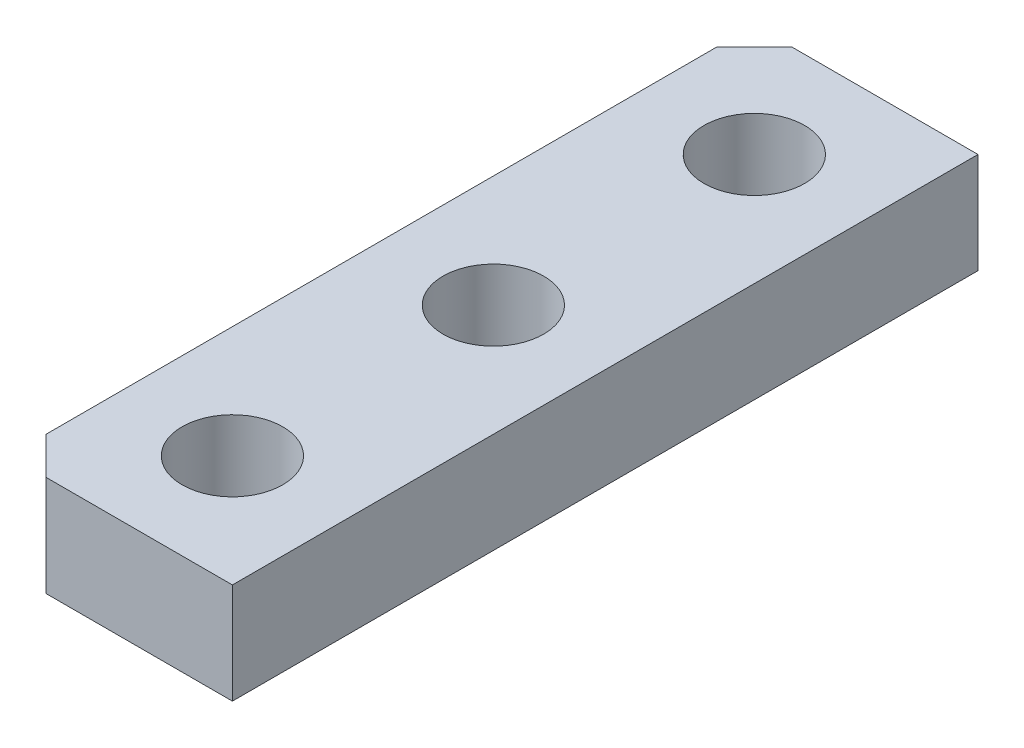
from build123d import *

# Parameters (mm, degrees)
SKETCH1_W             = 30
SKETCH1_H             = 100
BOSS_EXTRUDE1_DEPTH   = 13.5
M12_CLEARANCE_HOLE1_D = 13.5
CHAMFER1_SIZE         = 5


with BuildPart() as part:
    # Sketch1 → Boss-Extrude1 (new body)
    with BuildSketch(Plane(origin=(0, 0, 0), x_dir=(1, 0, 0), z_dir=(0, 1, 0))):
        Rectangle(SKETCH1_W, SKETCH1_H)
    extrude(amount=BOSS_EXTRUDE1_DEPTH)

    # M12 Clearance Hole1 (through all)
    with Locations(Plane(origin=(0, 13.5, 0), x_dir=(1, 0, 0), z_dir=(0, 1, 0))):
        with Locations((0, 35), (0, -35), (0, 0)):
            Hole(M12_CLEARANCE_HOLE1_D / 2)

    # Chamfer1
    chamfer1_edges = [part.edges().sort_by_distance(p)[0] for p in [
        (-15, 6.75, -50),
        (-15, 6.75, 50),
    ]]
    chamfer(chamfer1_edges, length=CHAMFER1_SIZE)


solid = part.part
